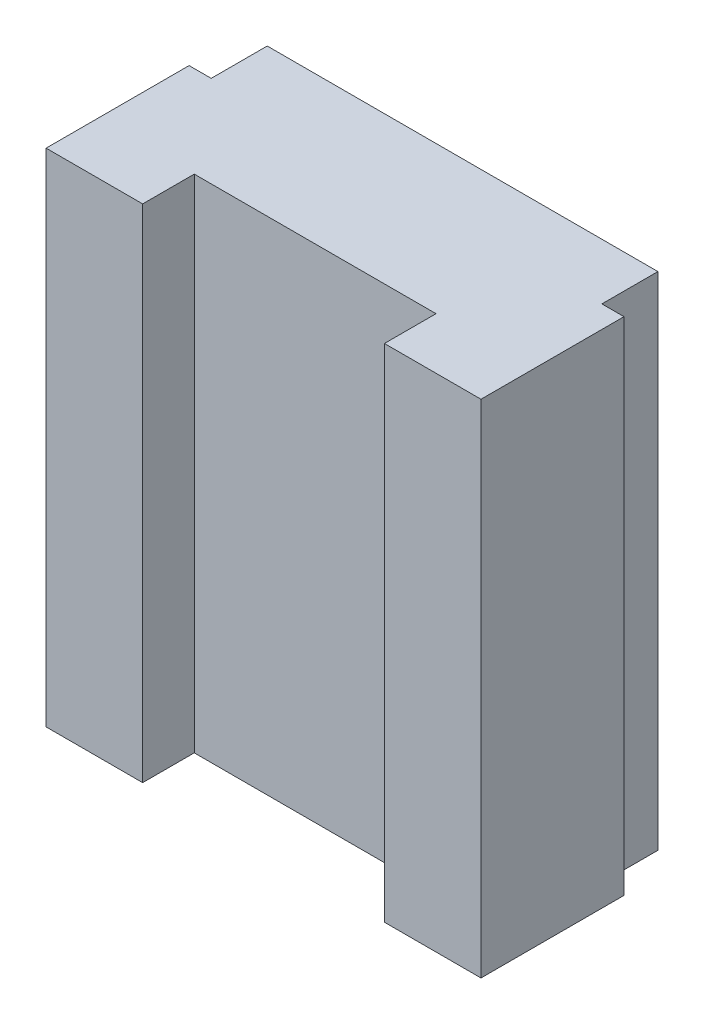
from build123d import *

# Parameters (mm, degrees)
SKETCH1_W           = 29.5
SKETCH1_H           = 34
BOSS_EXTRUDE1_DEPTH = 13.5
SKETCH2_W           = 1.5
SKETCH2_H           = 3.8
SKETCH2_W_2         = 16.4
SKETCH2_H_2         = 3.5
CUT_EXTRUDE1_DEPTH  = 40.443789118


with BuildPart() as part:
    # Sketch1 → Boss-Extrude1 (new body)
    with BuildSketch(Plane.XY):
        Rectangle(SKETCH1_W, SKETCH1_H)
    extrude(amount=BOSS_EXTRUDE1_DEPTH)

    # Sketch2 → Cut-Extrude1 (cut, through all)
    with BuildSketch(Plane(origin=(0, 17, 0), x_dir=(1, 0, 0), z_dir=(0, 1, 0))):
        with Locations((-14, -1.9)):
            Rectangle(SKETCH2_W, SKETCH2_H)
        with Locations((0, -11.75)):
            Rectangle(SKETCH2_W_2, SKETCH2_H_2)
    cut_extrude1 = extrude(amount=-CUT_EXTRUDE1_DEPTH, mode=Mode.SUBTRACT)

    # Mirror1: Cut-Extrude1 across plane
    add(cut_extrude1.mirror(Plane(origin=(0, 0, 0), x_dir=(0, 0, 1), z_dir=(1, 0, 0))), mode=Mode.SUBTRACT)


solid = part.part
